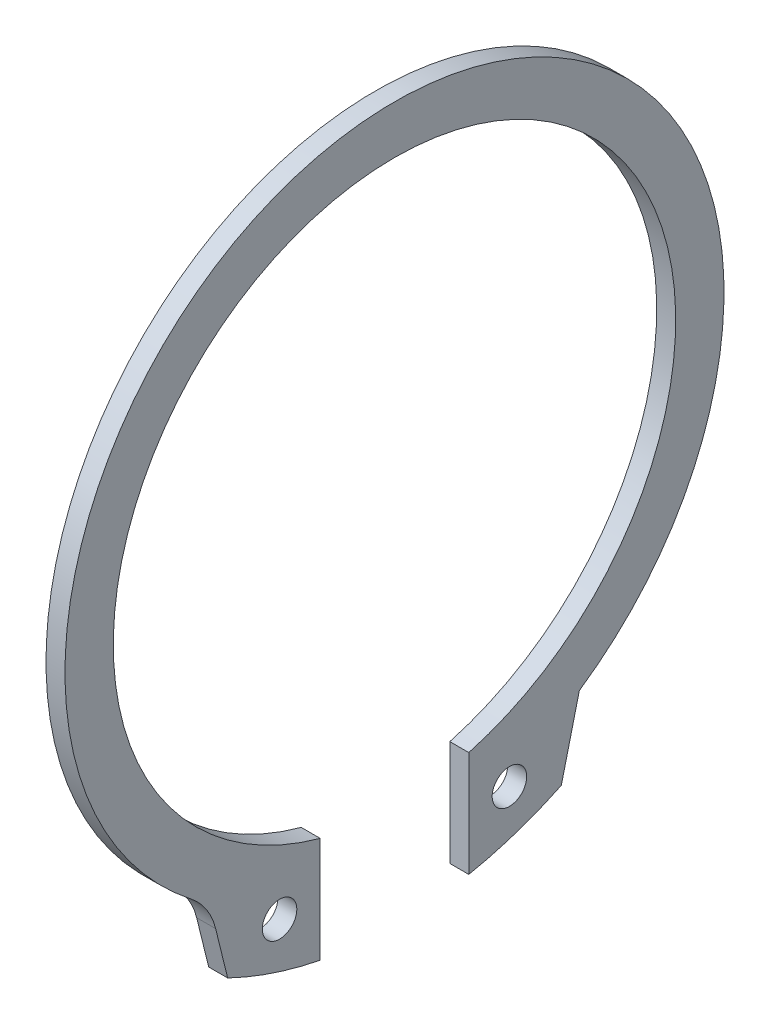
from build123d import *

# Parameters (mm, degrees)
ESQUISSE1_R        = 2.5
BOSS_EXTRU_1_DEPTH = 2.75


with BuildPart() as part:
    # Esquisse1 → Boss.-Extru.1 (new body)
    with BuildSketch(Plane(origin=(0, 0, 0), x_dir=(0, 0, -1), z_dir=(1, 0, 0))):
        with BuildLine():
            ThreePointArc((-25.916566448, -43.057123424), (-27.227783117, -40.022676723), (-29.456638889, -37.581497115))
            ThreePointArc((-29.456638889, -37.581497115), (1.652244952, 47.721405958), (26.786870524, -39.528800482))
            Line((26.786870524, -39.528800482), (24.173691188, -50.122960456))
            ThreePointArc((24.173691188, -50.122960456), (17.612583106, -52.787076324), (10.766267997, -54.596391675))
            Line((10.766267997, -54.596391675), (10.766267997, -39.302035233))
            ThreePointArc((10.766267997, -39.302035233), (0, 40.75), (-10.766267997, -39.302035233))
            Line((-10.766267997, -39.302035233), (-10.766267997, -54.596391675))
            ThreePointArc((-10.766267997, -54.596391675), (-17.612583106, -52.787076324), (-24.173691188, -50.122960456))
            Line((-24.173691188, -50.122960456), (-25.916566448, -43.057123424))
        make_face()
        with Locations((-16.653577526, -46.504624781)):
            Circle(ESQUISSE1_R, mode=Mode.SUBTRACT)
        with Locations((16.653577526, -46.504624781)):
            Circle(ESQUISSE1_R, mode=Mode.SUBTRACT)
    extrude(amount=BOSS_EXTRU_1_DEPTH)


solid = part.part
